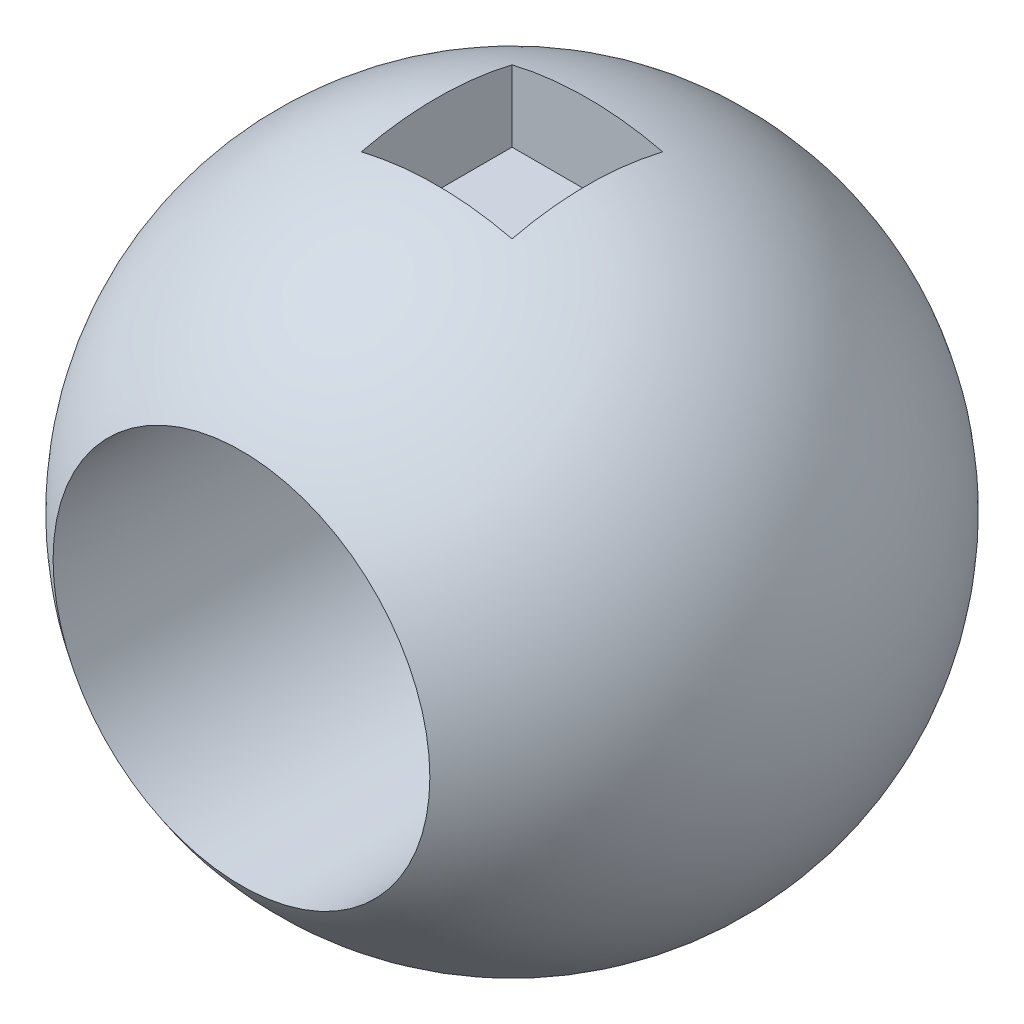
from build123d import *

# Parameters (mm, degrees)
SKETCH5_R          = 12.7
CUT_EXTRUDE2_DEPTH = 49.864135621
SKETCH6_W          = 10.16
SKETCH6_H          = 10.16
CUT_EXTRUDE3_DEPTH = 6


with BuildPart() as part:
    # Sketch4 → Revolve4 (revolve)
    with BuildSketch(Plane(origin=(0, 0, 0), x_dir=(1, 0, 0), z_dir=(0, 1, 0))):
        with BuildLine():
            Line((-12, 18.706967285), (0, 18.706967285))
            Line((0, 18.706967285), (0, -18.706967285))
            Line((0, -18.706967285), (-12, -18.706967285))
            ThreePointArc((-12, -18.706967285), (-22.225, 0), (-12, 18.706967285))
        make_face()
    revolve(axis=Axis((0, 0, -17.487077089), (0, 0, 1)))

    # Sketch5 → Cut-Extrude2 (cut, through all)
    with BuildSketch(Plane.XY.offset(18.706967285)):
        with Locations(Location((0, 0, 0), (0, 0, 180))):
            Circle(SKETCH5_R)
    extrude(amount=-CUT_EXTRUDE2_DEPTH, mode=Mode.SUBTRACT)

    # Sketch6 → Cut-Extrude3 (cut)
    with BuildSketch(Plane(origin=(0, 22.225, 0), x_dir=(1, 0, 0), z_dir=(0, 1, 0))):
        Rectangle(SKETCH6_W, SKETCH6_H)
    cut_extrude3 = extrude(amount=-CUT_EXTRUDE3_DEPTH, mode=Mode.SUBTRACT)

    # Mirror1: Cut-Extrude3 across plane
    add(cut_extrude3.mirror(Plane.ZX), mode=Mode.SUBTRACT)


solid = part.part
